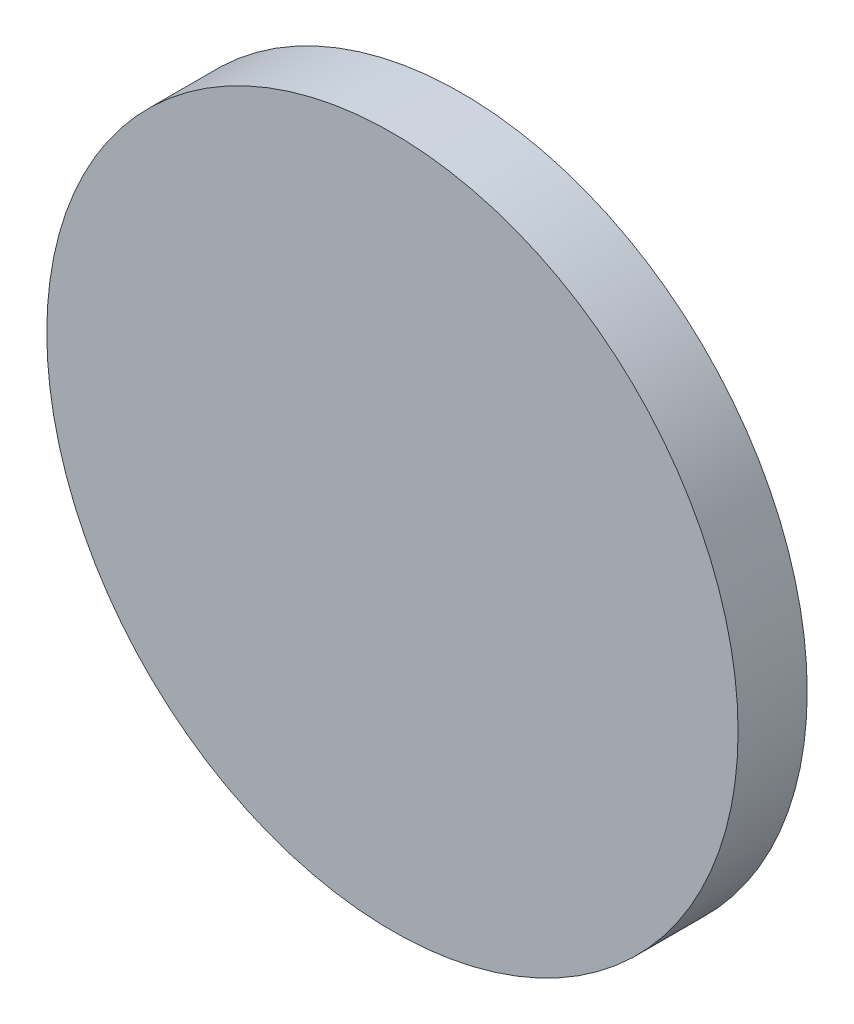
from build123d import *

# Parameters (mm, degrees)
SKETCH_S1_R     = 10
EXTRUDE_1_DEPTH = 1


with BuildPart() as part:
    # Sketch s1 → Extrude 1 (new, symmetric)
    with BuildSketch(Plane.XY):
        Circle(SKETCH_S1_R)
    extrude(amount=EXTRUDE_1_DEPTH, both=True)


solid = part.part
